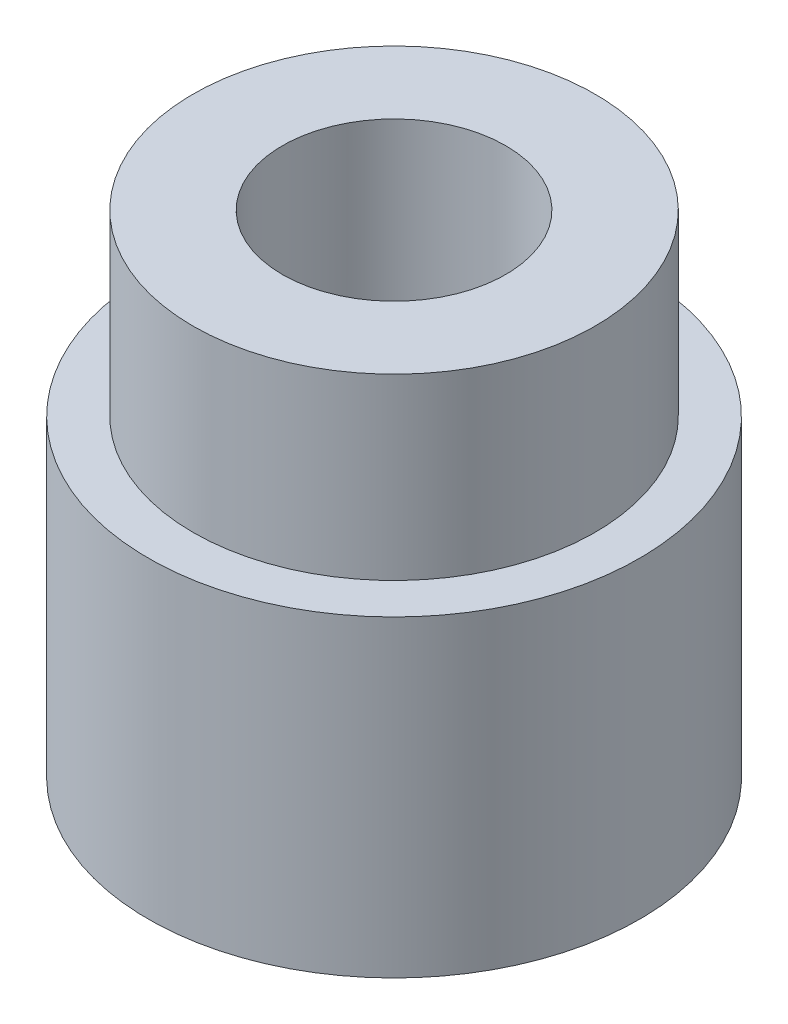
from build123d import *
from build123d.topology import SkipClean

# Parameters (mm, degrees)
SKETCH1_R           = 4.5
SKETCH1_R_2         = 2.5
BOSS_EXTRUDE1_DEPTH = 4
BOSS_EXTRUDE2_START = 7
SKETCH2_R           = 5.5
SKETCH2_R_2         = 2.5
BOSS_EXTRUDE2_DEPTH = 7


with BuildPart() as part:
    # Sketch1 → Boss-Extrude1 (new body)
    with BuildSketch(Plane(origin=(0, 0, 0), x_dir=(1, 0, 0), z_dir=(0, 1, 0))):
        with Locations(Location((0, 0, 0), (0, 0, 270))):
            Circle(SKETCH1_R)
        with Locations(Location((0, 0, 0), (0, 0, 270))):
            Circle(SKETCH1_R_2, mode=Mode.SUBTRACT)
    extrude(amount=BOSS_EXTRUDE1_DEPTH)

    # Sketch2 → Boss-Extrude2 (add)
    with SkipClean():  # the faces are left unmerged after this step: merging them gives an invalid solid
        with BuildSketch(Plane.XZ.offset(BOSS_EXTRUDE2_START)):
            with Locations(Location((0, 0, 0), (0, 0, 270))):
                Circle(SKETCH2_R)
            with Locations(Location((0, 0, 0), (0, 0, 270))):
                Circle(SKETCH2_R_2, mode=Mode.SUBTRACT)
        extrude(amount=-BOSS_EXTRUDE2_DEPTH)


solid = part.part
